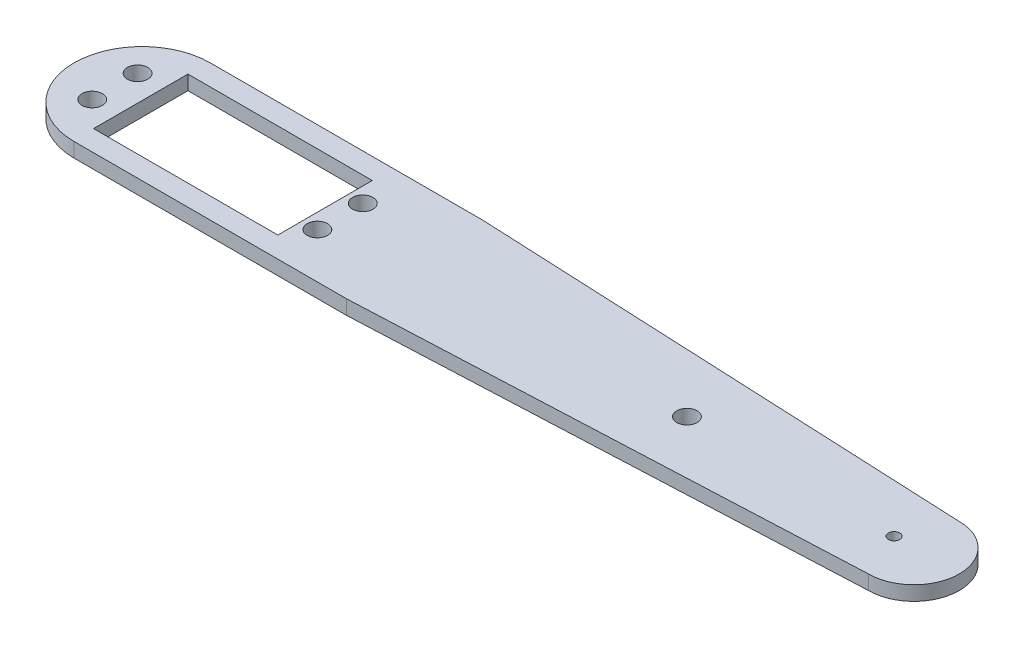
from build123d import *

# Parameters (mm, degrees)
SKETCH1_R           = 2.25
SKETCH1_R_2         = 1.25282433
SKETCH1_W           = 40.6
SKETCH1_H           = 20.8
BOSS_EXTRUDE1_DEPTH = 3.175


with BuildPart() as part:
    # Sketch1 → Boss-Extrude1 (new body)
    with BuildSketch(Plane(origin=(0, 0, 0), x_dir=(1, 0, 0), z_dir=(0, 1, 0))):
        with BuildLine():
            Line((-162.38735588, 17.244652891), (-102.38735588, 17.244652891))
            Line((-102.38735588, 17.244652891), (7.61264412, 12.244652891))
            ThreePointArc((7.61264412, 12.244652891), (17.61264412, 2.244652891), (7.61264412, -7.755347109))
            Line((7.61264412, -7.755347109), (-102.38735588, -12.755347109))
            Line((-102.38735588, -12.755347109), (-162.38735588, -12.755347109))
            ThreePointArc((-162.38735588, -12.755347109), (-177.38735588, 2.244652891), (-162.38735588, 17.244652891))
        make_face()
        with Locations(Location((-168.38735588, 7.244652891, 0), (0, 0, 270))):
            Circle(SKETCH1_R, mode=Mode.SUBTRACT)
        with Locations(Location((-168.38735588, -2.755347109, 0), (0, 0, 270))):
            Circle(SKETCH1_R, mode=Mode.SUBTRACT)
        with Locations(Location((-118.78735588, 7.244652891, 0), (0, 0, 270))):
            Circle(SKETCH1_R, mode=Mode.SUBTRACT)
        with Locations(Location((-118.78735588, -2.755347109, 0), (0, 0, 270))):
            Circle(SKETCH1_R, mode=Mode.SUBTRACT)
        with Locations(Location((-42.38735588, 2.244652891, 0), (0, 0, 270))):
            Circle(SKETCH1_R, mode=Mode.SUBTRACT)
        with Locations(Location((3.23764412, 2.246310682, 0), (0, 0, 270))):
            Circle(SKETCH1_R_2, mode=Mode.SUBTRACT)
        with Locations((-142.392621679, 2.244652891)):
            Rectangle(SKETCH1_W, SKETCH1_H, mode=Mode.SUBTRACT)
    extrude(amount=BOSS_EXTRUDE1_DEPTH)


solid = part.part
